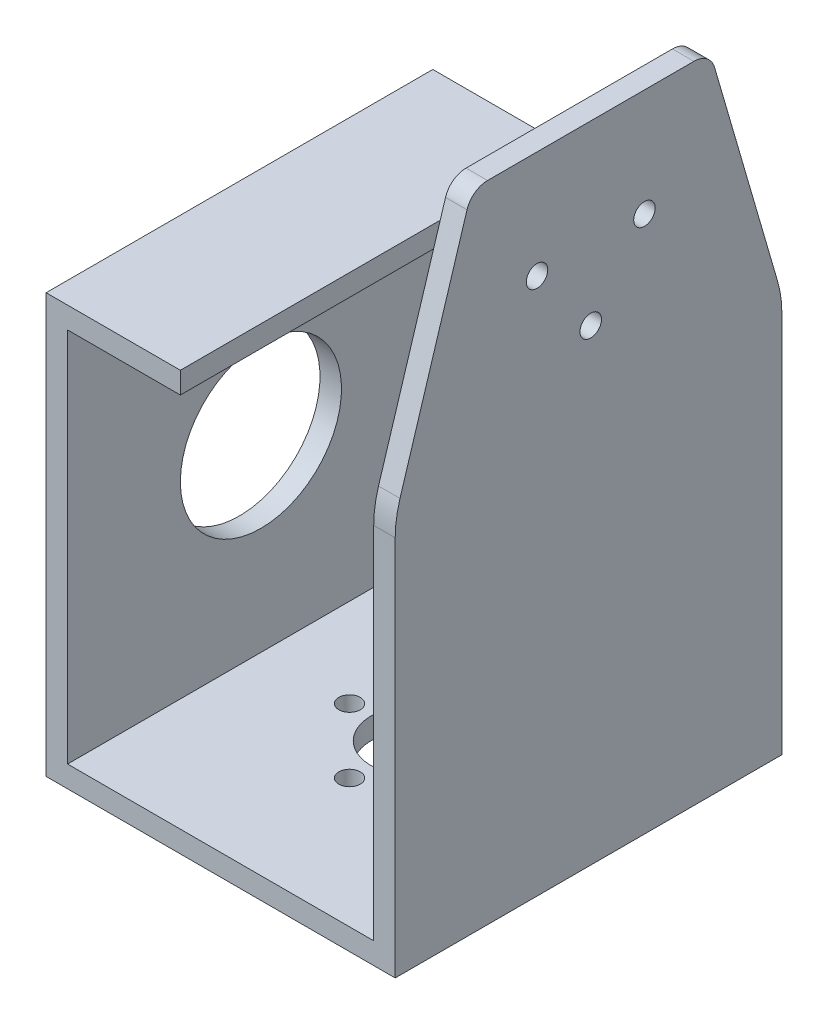
from build123d import *

# Parameters (mm, degrees)
BOSS_EXTRUDE1_DEPTH = 36
SKETCH2_OUTSIDE_W   = 53.43
SKETCH2_OUTSIDE_H   = 77.43
SKETCH2_OUTSIDE_R   = 1
CUT_EXTRUDE2_DEPTH  = 5
SKETCH3_R           = 7.5
CUT_EXTRUDE3_DEPTH  = 5
SKETCH4_R           = 4
SKETCH4_R_2         = 1
CUT_EXTRUDE5_DEPTH  = 5


with BuildPart() as part:
    # Sketch1 → Boss-Extrude1 (new body)
    with BuildSketch(Plane.XY):
        Polygon((0, 0), (-10.5, 0), (-10.5, -35), (18, -35), (18, 23), (20, 23), (20, -37), (-12.5, -37), (-12.5, 2), (0, 2), align=None)
    extrude(amount=BOSS_EXTRUDE1_DEPTH)

    # Sketch2 outside → Cut-Extrude2 (cut)
    # profile 1 of 4: a face of its own
    with BuildSketch(Plane(origin=(20, 0, 0), x_dir=(0, 0, -1), z_dir=(1, 0, 0))):
        with Locations((-18, -7)):
            Rectangle(SKETCH2_OUTSIDE_W, SKETCH2_OUTSIDE_H)
        with BuildLine():
            Line((-27.403498968, 23), (-8.191734442, 23))
            ThreePointArc((-8.191734442, 23), (-6.991166755, 22.599574078), (-6.271337492, 21.55863723))
            Line((-6.271337492, 21.55863723), (-0.398015251, 1.368235471))
            ThreePointArc((-0.398015251, 1.368235471), (-0.100003851, -0.014250056), (0, -1.424950681))
            Line((0, -1.424950681), (0, -37))
            Line((0, -37), (-36, -37))
            Line((-36, -37), (-36, -1.512851617))
            ThreePointArc((-36, -1.512851617), (-35.887491609, -0.01702085), (-35.552498063, 1.445151214))
            Line((-35.552498063, 1.445151214), (-29.313998581, 21.591600566))
            ThreePointArc((-29.313998581, 21.591600566), (-28.590259025, 22.609844889), (-27.403498968, 23))
        make_face(mode=Mode.SUBTRACT)
    # profile 2 of 4: a face of its own
    with BuildSketch(Plane(origin=(20, 0, 0), x_dir=(0, 0, -1), z_dir=(1, 0, 0))):
        with Locations((-17.797616705, 6.5)):
            Circle(SKETCH2_OUTSIDE_R)
    # profile 3 of 4: a face of its own
    with BuildSketch(Plane(origin=(20, 0, 0), x_dir=(0, 0, -1), z_dir=(1, 0, 0))):
        with Locations((-22.797616705, 13)):
            Circle(SKETCH2_OUTSIDE_R)
    # profile 4 of 4: a face of its own
    with BuildSketch(Plane(origin=(20, 0, 0), x_dir=(0, 0, -1), z_dir=(1, 0, 0))):
        with Locations((-12.797616705, 13)):
            Circle(SKETCH2_OUTSIDE_R)
    extrude(amount=-CUT_EXTRUDE2_DEPTH, mode=Mode.SUBTRACT)

    # Sketch3 → Cut-Extrude3 (cut)
    with BuildSketch(Plane.ZY.offset(12.5)):
        with Locations((18, -17.5)):
            Circle(SKETCH3_R)
    extrude(amount=-CUT_EXTRUDE3_DEPTH, mode=Mode.SUBTRACT)

    # Sketch4 → Cut-Extrude5 (cut)
    with BuildSketch(Plane.XZ.offset(37)):
        with Locations(Location((3.75, 18, 0), (0, 0, 270))):
            Circle(SKETCH4_R)
        with Locations(Location((3.75, 12, 0), (0, 0, 270))):
            Circle(SKETCH4_R_2)
        with Locations(Location((3.75, 24, 0), (0, 0, 270))):
            Circle(SKETCH4_R_2)
        with Locations(Location((9.75, 18, 0), (0, 0, 270))):
            Circle(SKETCH4_R_2)
        with Locations(Location((-2.25, 18, 0), (0, 0, 270))):
            Circle(SKETCH4_R_2)
    extrude(amount=-CUT_EXTRUDE5_DEPTH, mode=Mode.SUBTRACT)


solid = part.part
